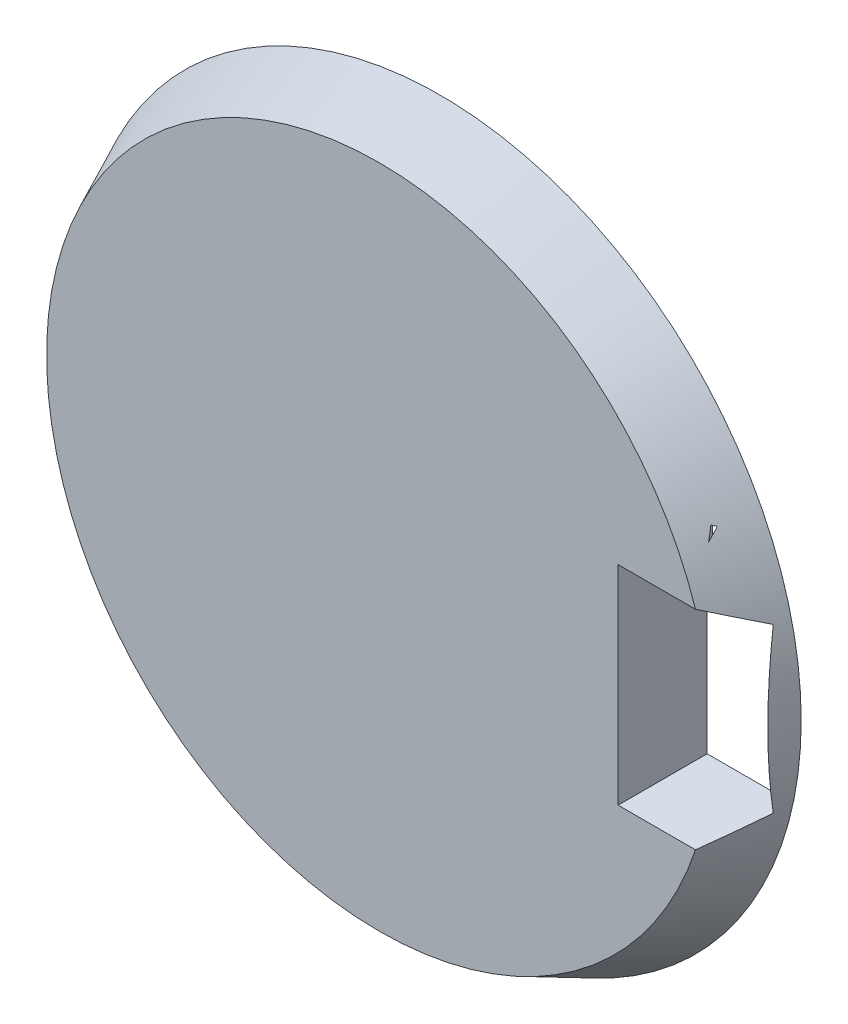
from build123d import *

# Parameters (mm, degrees)
SKETCH1_R           = 11.9
SKETCH1_W           = 2.4
SKETCH1_H           = 5
BOSS_EXTRUDE2_DEPTH = 2
BOSS_EXTRUDE2_TAPER = 25
SKETCH4_W           = 1.199715213
SKETCH4_H           = 2.206755838
CUT_EXTRUDE1_DEPTH  = 2


with BuildPart() as part:
    # Sketch1 → Boss-Extrude2 (new body)
    with BuildSketch(Plane.XY):
        Circle(SKETCH1_R)
        with Locations((10, 0)):
            Rectangle(SKETCH1_W, SKETCH1_H, mode=Mode.SUBTRACT)
    extrude(amount=BOSS_EXTRUDE2_DEPTH, taper=BOSS_EXTRUDE2_TAPER)

    # Sketch4 → Cut-Extrude1 (cut)
    with BuildSketch(Plane(origin=(0, 2.053484512, -0.957555554), x_dir=(1, 0, 0), z_dir=(0, -0.9063077870366496, 0.42261826174070033))):
        with Locations((9.570937649, 2.159923573)):
            Rectangle(SKETCH4_W, SKETCH4_H)
    extrude(amount=-CUT_EXTRUDE1_DEPTH, mode=Mode.SUBTRACT)


solid = part.part
